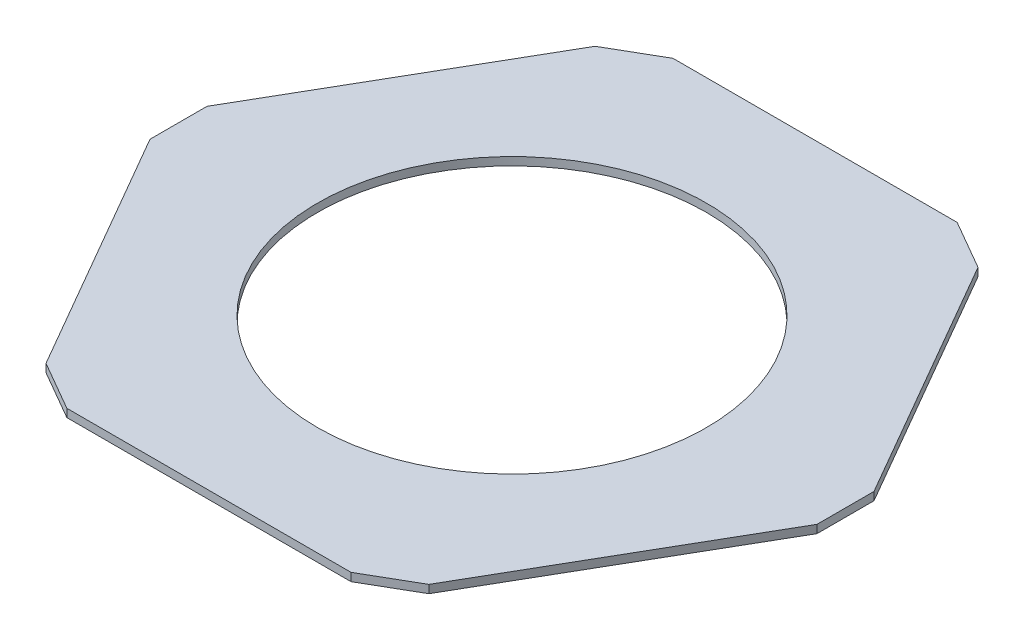
from build123d import *

# Parameters (mm, degrees)
BOSS_EXTRUDE1_DEPTH = 25
CUT_EXTRUDE1_REACH  = 1392.455
SKETCH2_R           = 600


with BuildPart() as part:
    # Sketch1 → Boss-Extrude1 (new body)
    with BuildSketch(Plane(origin=(0, 0, 0), x_dir=(1, 0, 0), z_dir=(0, 1, 0))):
        Polygon((438.317943801, 934.970880832), (590.549562699, 847.079914683), (1028.8675065, 87.89096615), (1028.8675065, -87.89096615), (590.549562699, -847.079914683), (438.317943801, -934.970880832), (-438.317943801, -934.970880832), (-590.549562699, -847.079914683), (-1028.8675065, -87.89096615), (-1028.8675065, 87.89096615), (-590.549562699, 847.079914683), (-438.317943801, 934.970880832), align=None)
    extrude(amount=BOSS_EXTRUDE1_DEPTH)

    # Sketch2 → Cut-Extrude1 (cut, up to next)
    with BuildSketch(Plane(origin=(0, 25, 0), x_dir=(1, 0, 0), z_dir=(0, 1, 0)), mode=Mode.PRIVATE) as cut_extrude1_sk1:
        with Locations(Location((0, 0, 0), (0, 0, 270))):
            Circle(SKETCH2_R)
    cut_extrude1_tool1 = extrude(cut_extrude1_sk1.sketch, amount=-CUT_EXTRUDE1_REACH, mode=Mode.PRIVATE) & part.part
    add(cut_extrude1_tool1.solids().sort_by_distance((0, 25, 0))[0], mode=Mode.SUBTRACT)


solid = part.part
